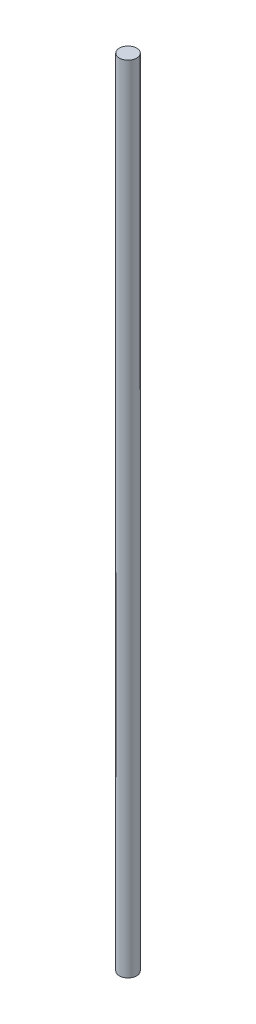
from build123d import *

# Parameters (mm, degrees)
SKETCH1_R           = 5
BOSS_EXTRUDE1_DEPTH = 458


with BuildPart() as part:
    # Sketch1 → Boss-Extrude1 (new body)
    with BuildSketch(Plane(origin=(0, 0, 0), x_dir=(1, 0, 0), z_dir=(0, 1, 0))):
        with Locations(Location((0, 0, 0), (0, 0, 90))):
            Circle(SKETCH1_R)
    extrude(amount=BOSS_EXTRUDE1_DEPTH)


solid = part.part
